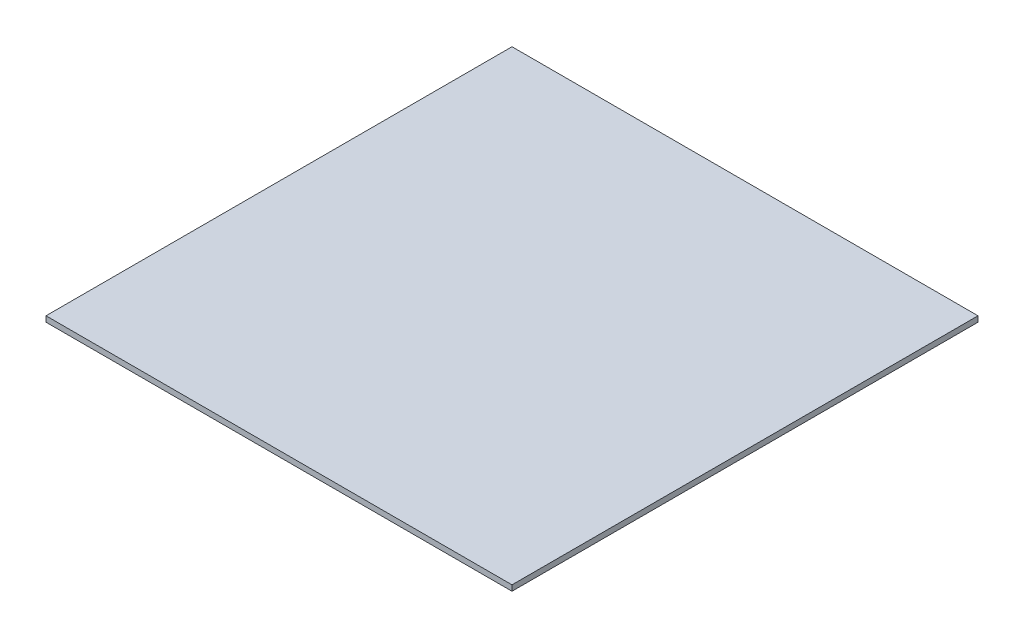
from build123d import *

# Parameters (mm, degrees)
SKETCH1_W           = 250
SKETCH1_H           = 250
BOSS_EXTRUDE1_DEPTH = 1.5


with BuildPart() as part:
    # Sketch1 → Boss-Extrude1 (new, symmetric)
    with BuildSketch(Plane(origin=(0, 0, 0), x_dir=(1, 0, 0), z_dir=(0, 1, 0))):
        Rectangle(SKETCH1_W, SKETCH1_H)
    extrude(amount=BOSS_EXTRUDE1_DEPTH, both=True)


solid = part.part
